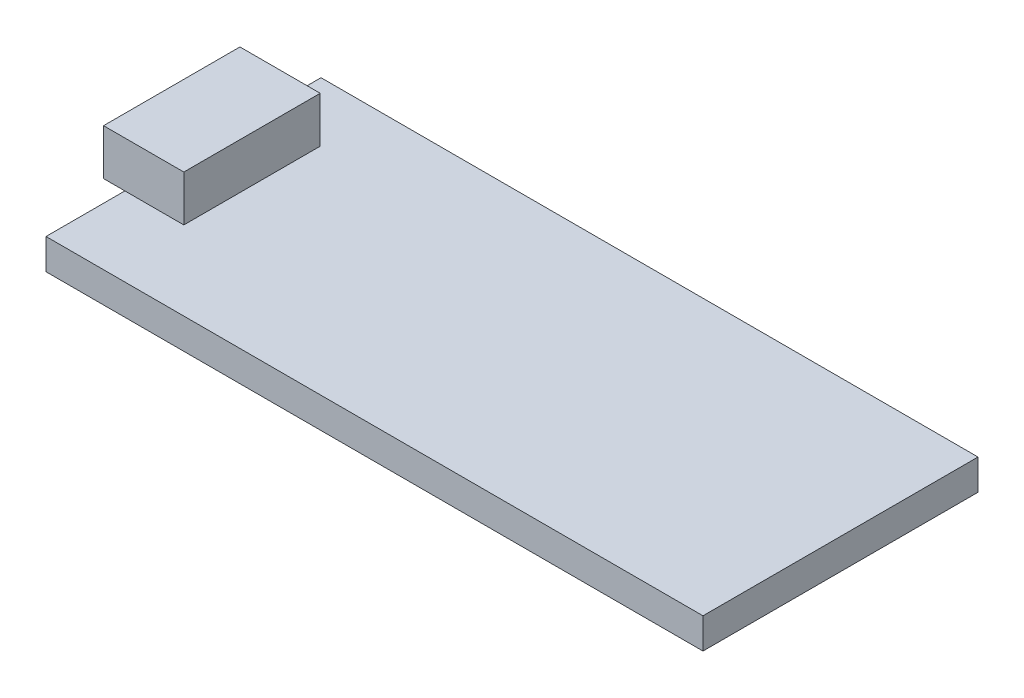
from build123d import *

# Parameters (mm, degrees)
SKETCH1_W           = 43
SKETCH1_H           = 18
BOSS_EXTRUDE1_DEPTH = 2
SKETCH2_W           = 5.254162635
SKETCH2_H           = 8.926105841
BOSS_EXTRUDE2_DEPTH = 3


with BuildPart() as part:
    # Sketch1 → Boss-Extrude1 (new body)
    with BuildSketch(Plane(origin=(0, 0, 0), x_dir=(1, 0, 0), z_dir=(0, 1, 0))):
        with Locations((21.5, -9)):
            Rectangle(SKETCH1_W, SKETCH1_H)
    extrude(amount=BOSS_EXTRUDE1_DEPTH)

    # Sketch2 → Boss-Extrude2 (add)
    with BuildSketch(Plane(origin=(0, 2, 0), x_dir=(1, 0, 0), z_dir=(0, 1, 0))):
        with Locations((1.22967938, -8.373082868)):
            Rectangle(SKETCH2_W, SKETCH2_H)
    extrude(amount=BOSS_EXTRUDE2_DEPTH)


solid = part.part
